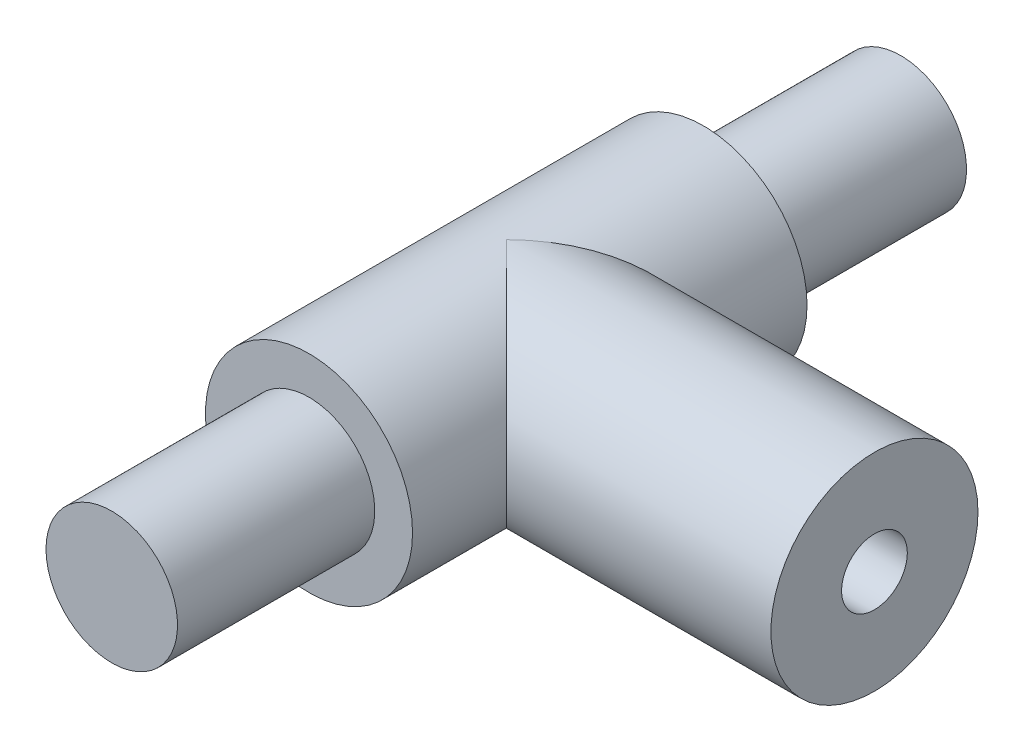
from build123d import *

# Parameters (mm, degrees)
SKETCH1_R           = 5
BOSS_EXTRUDE1_DEPTH = 9.525
SKETCH5_R           = 3.175
BOSS_EXTRUDE4_DEPTH = 19.05
SKETCH6_R           = 5
BOSS_EXTRUDE5_DEPTH = 17.78
SKETCH7_R           = 1.5875
CUT_EXTRUDE1_DEPTH  = 12.7


with BuildPart() as part:
    # Sketch1 → Boss-Extrude1 (new, symmetric)
    with BuildSketch(Plane.XY):
        with Locations(Location((0, 0, 0), (0, 0, 180))):
            Circle(SKETCH1_R)
    extrude(amount=BOSS_EXTRUDE1_DEPTH, both=True)

    # Sketch5 → Boss-Extrude4 (add, symmetric)
    with BuildSketch(Plane.XY):
        with Locations(Location((0, 0, 0), (0, 0, 180))):
            Circle(SKETCH5_R)
    extrude(amount=BOSS_EXTRUDE4_DEPTH, both=True)

    # Sketch6 → Boss-Extrude5 (add)
    with BuildSketch(Plane(origin=(0, 0, 0), x_dir=(0, 0, -1), z_dir=(1, 0, 0))):
        Circle(SKETCH6_R)
    extrude(amount=BOSS_EXTRUDE5_DEPTH)

    # Sketch7 → Cut-Extrude1 (cut)
    with BuildSketch(Plane(origin=(17.78, 0, 0), x_dir=(0, 0, -1), z_dir=(1, 0, 0))):
        Circle(SKETCH7_R)
    extrude(amount=-CUT_EXTRUDE1_DEPTH, mode=Mode.SUBTRACT)


solid = part.part
